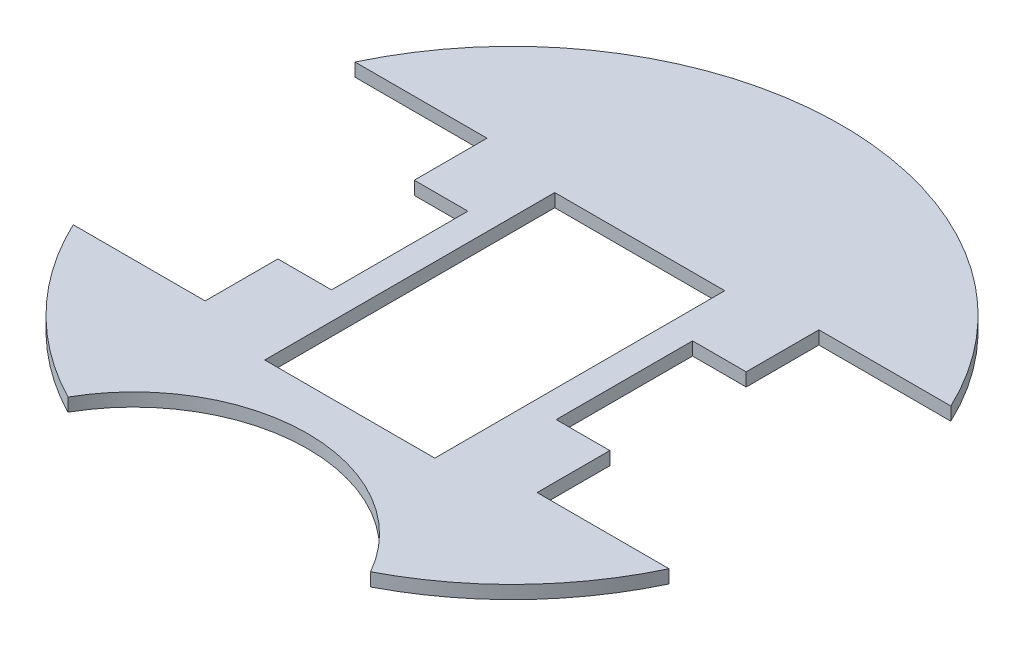
from build123d import *

# Parameters (mm, degrees)
BOSS_EXTRUDE1_DEPTH  = 2.9
SOLENOID_PLACEMENT_W = 37.4
SOLENOID_PLACEMENT_H = 63.8
CUT_EXTRUDE1_DEPTH   = 103.571487266
CUT_EXTRUDE2_DEPTH   = 103.571487266


with BuildPart() as part:
    # Sketch1 → Boss-Extrude1 (new body)
    with BuildSketch(Plane(origin=(0, 0, 0), x_dir=(1, 0, 0), z_dir=(0, 1, 0))):
        with BuildLine():
            ThreePointArc((33.29110537, -64.404598464), (0, 72.5), (-33.29110537, -64.404598464))
            ThreePointArc((-33.29110537, -64.404598464), (0, -44.989799638), (33.29110537, -64.404598464))
        make_face()
    extrude(amount=BOSS_EXTRUDE1_DEPTH)

    # solenoid placement → Cut-Extrude1 (cut, through all)
    with BuildSketch(Plane(origin=(0, 2.9, 0), x_dir=(1, 0, 0), z_dir=(0, 1, 0))):
        with Locations((0, -3.8)):
            Rectangle(SOLENOID_PLACEMENT_W, SOLENOID_PLACEMENT_H)
    extrude(amount=-CUT_EXTRUDE1_DEPTH, mode=Mode.SUBTRACT)

    # Sketch2 → Cut-Extrude2 (cut, through all)
    with BuildSketch(Plane(origin=(0, 2.9, 0), x_dir=(1, 0, 0), z_dir=(0, 1, 0))):
        with BuildLine():
            Line((-36.51, -15), (-24.71, -15))
            Line((-24.71, -15), (-24.71, 15))
            Line((-24.71, 15), (-36.51, 15))
            Line((-36.51, 15), (-36.51, 31))
            Line((-36.51, 31), (-65.538156825, 31))
            ThreePointArc((-65.538156825, 31), (-72.5, 0), (-65.538156825, -31))
            Line((-65.538156825, -31), (-36.51, -31))
            Line((-36.51, -31), (-36.51, -15))
        make_face()
        with BuildLine():
            Line((36.51, -31), (65.538156825, -31))
            ThreePointArc((65.538156825, -31), (72.5, 0), (65.538156825, 31))
            Line((65.538156825, 31), (36.51, 31))
            Line((36.51, 31), (36.51, 15))
            Line((36.51, 15), (24.71, 15))
            Line((24.71, 15), (24.71, -15))
            Line((24.71, -15), (36.51, -15))
            Line((36.51, -15), (36.51, -31))
        make_face()
    extrude(amount=-CUT_EXTRUDE2_DEPTH, mode=Mode.SUBTRACT)


solid = part.part
